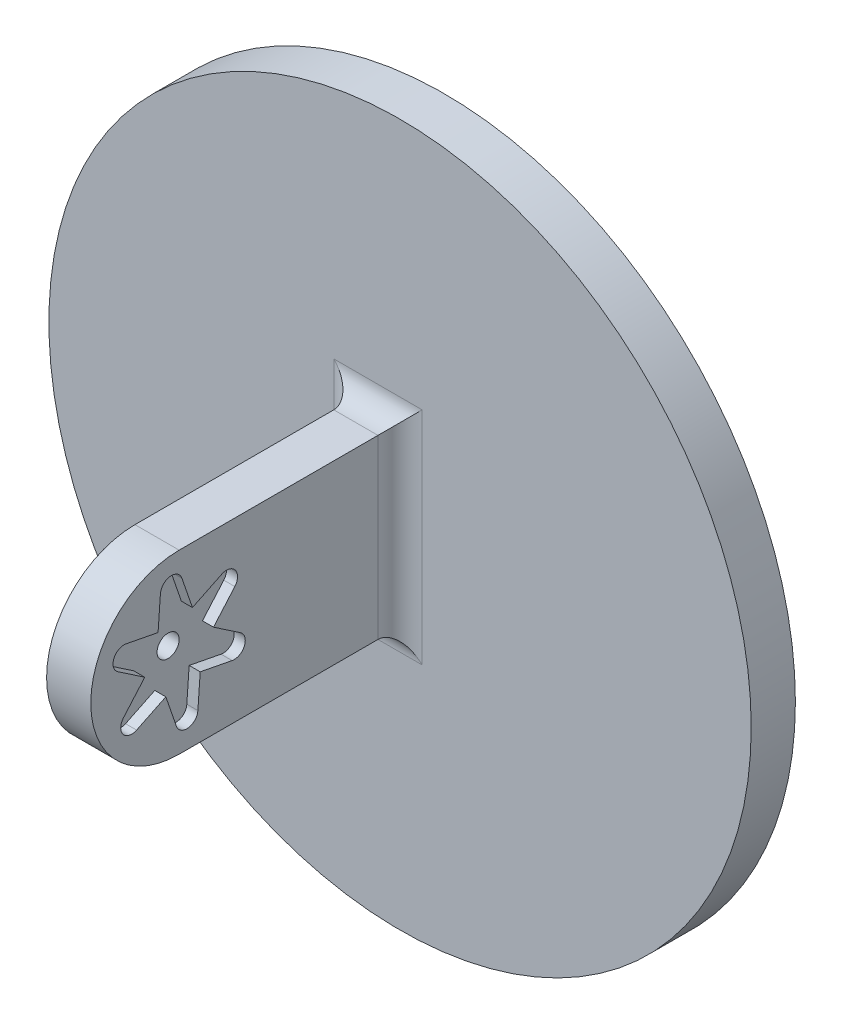
from build123d import *

# Parameters (mm, degrees)
SKETCH1_R           = 79.480373192
BOSS_EXTRUDE1_DEPTH = 10
BOSS_EXTRUDE2_DEPTH = 70
FILLET3_R           = 5
SKETCH7_R           = 2.5
CUT_EXTRUDE4_DEPTH  = 138.964703622
CUT_EXTRUDE6_DEPTH  = 2.5
FILLET5_RADIUS      = 20
FILLET5_LENGTH      = 10
CUT_EXTRUDE7_DEPTH  = 2.5


with BuildPart() as part:
    # Sketch1 → Boss-Extrude1 (new body)
    with BuildSketch(Plane.XY):
        Circle(SKETCH1_R)
    extrude(amount=BOSS_EXTRUDE1_DEPTH)

    # Sketch2 → Boss-Extrude2 (add)
    with BuildSketch(Plane.XY.offset(10)):
        Polygon((0, 0), (0, -20), (-10, -20), (-10, 20), (0, 20), align=None)
    extrude(amount=BOSS_EXTRUDE2_DEPTH)

    # Fillet3
    fillet3_edges = [part.edges().sort_by_distance(p)[0] for p in [
        (-5, 20, 10),
        (-10, 0, 10),
        (-5, -20, 10),
        (0, 0, 10),
    ]]
    fillet(fillet3_edges, radius=FILLET3_R)

    # Sketch7 → Cut-Extrude4 (cut, through all)
    with BuildSketch(Plane(origin=(0, 0, 0), x_dir=(0, 0, -1), z_dir=(1, 0, 0))):
        with Locations(Location((-60, 0, 0), (0, 0, 90))):
            Circle(SKETCH7_R)
    extrude(amount=-CUT_EXTRUDE4_DEPTH, mode=Mode.SUBTRACT)

    # Sketch9 → Cut-Extrude6 (cut)
    with BuildSketch(Plane(origin=(0, 0, 0), x_dir=(0, 0, -1), z_dir=(1, 0, 0))):
        with BuildLine():
            Line((-64.239646316, 13.566264372), (-64.768269058, 6.229526416))
            Line((-64.768269058, 6.229526416), (-71.988493293, 7.63506113))
            ThreePointArc((-71.988493293, 7.63506113), (-74.774746239, 6.140592282), (-73.868552739, 3.111490773))
            Line((-73.868552739, 3.111490773), (-67.779062658, -1.014678928))
            Line((-67.779062658, -1.014678928), (-72.606403544, -6.56480918))
            ThreePointArc((-72.606403544, -6.56480918), (-72.70528203, -9.725009436), (-69.628906423, -10.454773599))
            Line((-69.628906423, -10.454773599), (-63.010793601, -7.244205344))
            Line((-63.010793601, -7.244205344), (-60.617910251, -14.19987031))
            ThreePointArc((-60.617910251, -14.19987031), (-57.930535791, -15.865601718), (-55.760353684, -13.566264372))
            Line((-55.760353684, -13.566264372), (-55.231730942, -6.229526416))
            Line((-55.231730942, -6.229526416), (-48.011506707, -7.63506113))
            ThreePointArc((-48.011506707, -7.63506113), (-45.225253761, -6.140592282), (-46.131447261, -3.111490773))
            Line((-46.131447261, -3.111490773), (-52.220937342, 1.014678928))
            Line((-52.220937342, 1.014678928), (-47.393596456, 6.56480918))
            ThreePointArc((-47.393596456, 6.56480918), (-47.29471797, 9.725009436), (-50.371093577, 10.454773599))
            Line((-50.371093577, 10.454773599), (-56.989206399, 7.244205344))
            Line((-56.989206399, 7.244205344), (-59.382089749, 14.19987031))
            ThreePointArc((-59.382089749, 14.19987031), (-62.069464209, 15.865601718), (-64.239646316, 13.566264372))
        make_face()
    extrude(amount=-CUT_EXTRUDE6_DEPTH, mode=Mode.SUBTRACT)

    # Fillet5: full round fillet: the end face becomes a half cylinder, R = half its width
    fillet5_face = Plane((-5, 0, 80), x_dir=(-1, 0, 0), z_dir=(0, 0, 1))  # on the end face: x along it, z out of the body
    fillet5_slab = fillet5_face.offset(-FILLET5_RADIUS / 2) * Box(FILLET5_LENGTH, 2 * FILLET5_RADIUS, FILLET5_RADIUS, mode=Mode.PRIVATE)  # the body's end, R deep
    fillet5_round = Plane((-5, 0, 60), x_dir=(0, 0, 1), z_dir=(-1, 0, 0)) * Cylinder(FILLET5_RADIUS, FILLET5_LENGTH, mode=Mode.PRIVATE)  # its axis R under the face
    add(fillet5_slab - fillet5_round, mode=Mode.SUBTRACT)

    # Sketch4 → Cut-Extrude7 (cut)
    with BuildSketch(Plane(origin=(0, 0, 0), x_dir=(-1, 0, 0), z_dir=(0, 0, -1))):
        with BuildLine():
            Line((-9.121537298, 10.900260879), (-6.793934197, 3.922479738))
            Line((-6.793934197, 3.922479738), (-14.000671478, 2.449352582))
            ThreePointArc((-14.000671478, 2.449352582), (-16, 0), (-14.000671478, -2.449352582))
            Line((-14.000671478, -2.449352582), (-6.793934197, -3.922479738))
            Line((-6.793934197, -3.922479738), (-9.121537298, -10.900260879))
            ThreePointArc((-9.121537298, -10.900260879), (-8, -13.856406461), (-4.87913418, -13.349613461))
            Line((-4.87913418, -13.349613461), (0, -7.844959475))
            Line((0, -7.844959475), (4.87913418, -13.349613461))
            ThreePointArc((4.87913418, -13.349613461), (8, -13.856406461), (9.121537298, -10.900260879))
            Line((9.121537298, -10.900260879), (6.793934197, -3.922479738))
            Line((6.793934197, -3.922479738), (14.000671478, -2.449352582))
            ThreePointArc((14.000671478, -2.449352582), (16, 0), (14.000671478, 2.449352582))
            Line((14.000671478, 2.449352582), (6.793934197, 3.922479738))
            Line((6.793934197, 3.922479738), (9.121537298, 10.900260879))
            ThreePointArc((9.121537298, 10.900260879), (8, 13.856406461), (4.87913418, 13.349613461))
            Line((4.87913418, 13.349613461), (0, 7.844959475))
            Line((0, 7.844959475), (-4.87913418, 13.349613461))
            ThreePointArc((-4.87913418, 13.349613461), (-8, 13.856406461), (-9.121537298, 10.900260879))
        make_face()
    extrude(amount=-CUT_EXTRUDE7_DEPTH, mode=Mode.SUBTRACT)


solid = part.part
